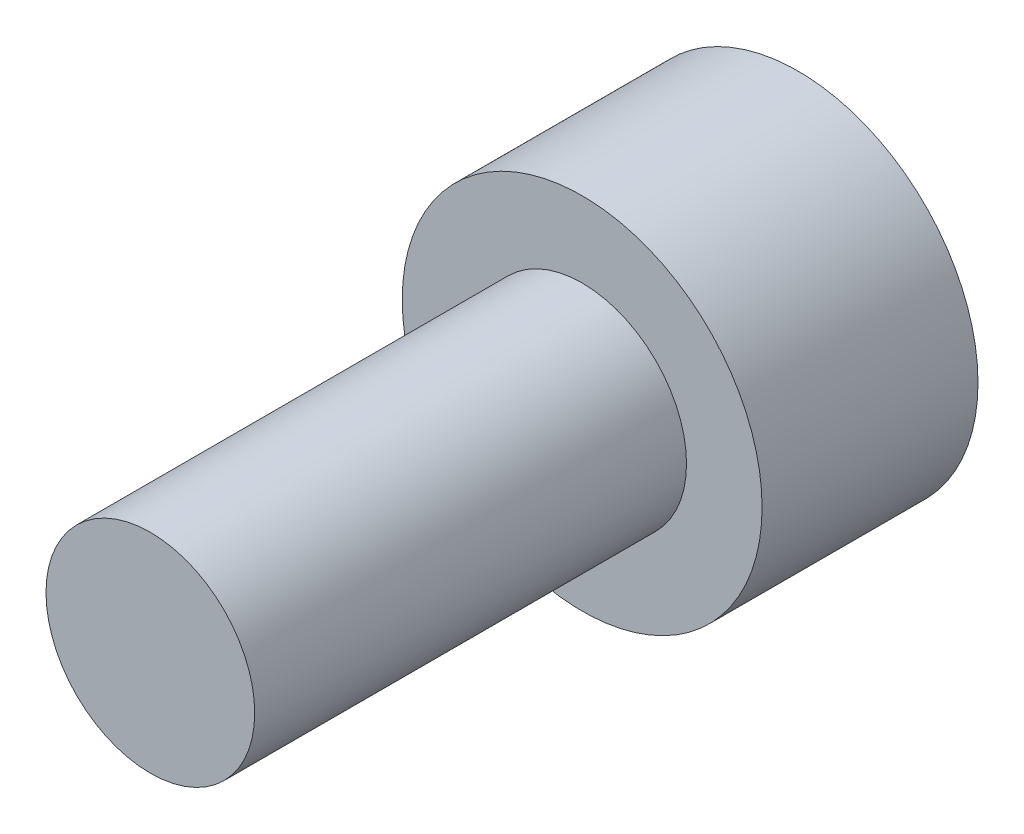
from build123d import *

# Parameters (mm, degrees)
SKIZZE1_R                       = 2.9
AUFSATZ_LINEAR_AUSTRAGEN1_DEPTH = 18
SKIZZE1_3_R                     = 5
SKIZZE1_3_R_2                   = 2.9
AUFSATZ_LINEAR_AUSTRAGEN2_DEPTH = 6


with BuildPart() as part:
    # Skizze1 → Aufsatz-Linear austragen1 (new body)
    with BuildSketch(Plane.XY):
        Circle(SKIZZE1_R)
    extrude(amount=AUFSATZ_LINEAR_AUSTRAGEN1_DEPTH)

    # Skizze1<3> → Aufsatz-Linear austragen2 (add)
    with BuildSketch(Plane.XY):
        Circle(SKIZZE1_3_R)
        Circle(SKIZZE1_3_R_2, mode=Mode.SUBTRACT)
    extrude(amount=AUFSATZ_LINEAR_AUSTRAGEN2_DEPTH)


solid = part.part
